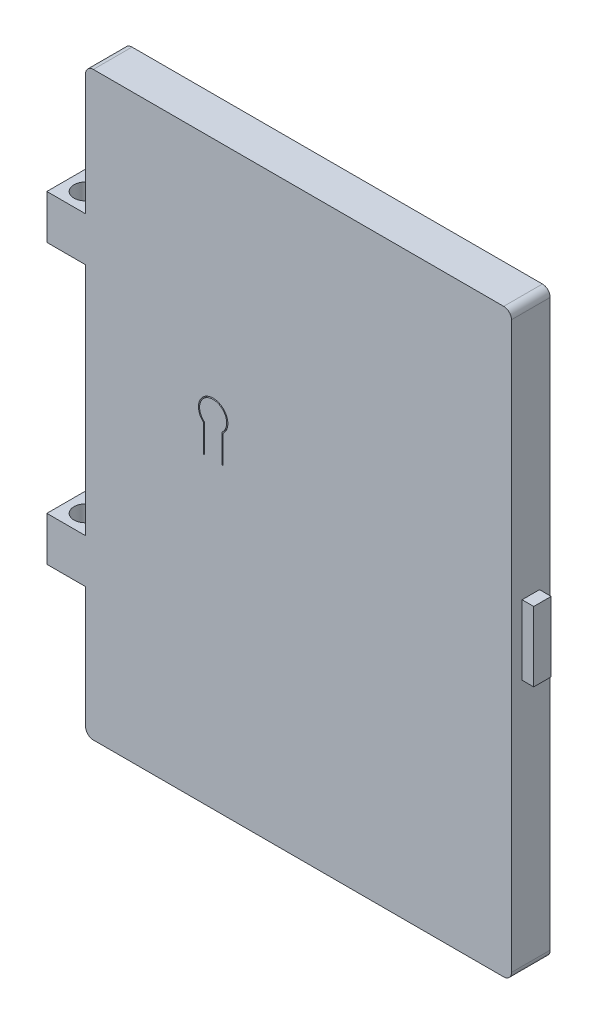
from build123d import *

# Parameters (mm, degrees)
SKETCH1_W           = 110
SKETCH1_H           = 150
BOSS_EXTRUDE1_DEPTH = 10
CUT_EXTRUDE1_DEPTH  = 6
SKETCH3_R           = 2.5
BOSS_EXTRUDE2_DEPTH = 18
CUT_EXTRUDE2_START  = -12
SKETCH5_R           = 1.1
CUT_EXTRUDE2_DEPTH  = 5
CUT_EXTRUDE3_START  = 0.5
CUT_EXTRUDE3_DEPTH  = 4
SKETCH7_R           = 1.875
BOSS_EXTRUDE3_DEPTH = 11.5
CUT_EXTRUDE4_DEPTH  = 4
SKETCH9_W           = 10
SKETCH9_H           = 11.4
BOSS_EXTRUDE4_DEPTH = 10
SKETCH10_R          = 3
CUT_EXTRUDE5_DEPTH  = 161.819432905
SKETCH11_W          = 4.5
SKETCH11_H          = 18
BOSS_EXTRUDE5_DEPTH = 3
FILLET1_R           = 2


with BuildPart() as part:
    # Sketch1 → Boss-Extrude1 (new body)
    with BuildSketch(Plane.XY):
        with Locations((55, 75)):
            Rectangle(SKETCH1_W, SKETCH1_H)
    extrude(amount=BOSS_EXTRUDE1_DEPTH)

    # Sketch2 → Cut-Extrude1 (cut)
    with BuildSketch(Plane(origin=(0, 0, 0), x_dir=(-1, 0, 0), z_dir=(0, 0, -1))):
        with BuildLine():
            Line((-93, 53), (-7, 53))
            ThreePointArc((-7, 53), (-5.585786438, 53.585786438), (-5, 55))
            Line((-5, 55), (-5, 113))
            ThreePointArc((-5, 113), (-5.585786438, 114.414213562), (-7, 115))
            Line((-7, 115), (-93, 115))
            ThreePointArc((-93, 115), (-94.414213562, 114.414213562), (-95, 113))
            Line((-95, 113), (-95, 55))
            ThreePointArc((-95, 55), (-94.414213562, 53.585786438), (-93, 53))
        make_face()
    extrude(amount=-CUT_EXTRUDE1_DEPTH, mode=Mode.SUBTRACT)

    # Sketch3 → Boss-Extrude2 (add)
    with BuildSketch(Plane(origin=(0, 0, 6), x_dir=(-1, 0, 0), z_dir=(0, 0, -1))):
        with Locations(Location((-91.46, 95.2, 0), (0, 0, 180))):
            Circle(SKETCH3_R)
        with Locations(Location((-70.96, 111.2, 0), (0, 0, 180))):
            Circle(SKETCH3_R)
        with Locations(Location((-9.46, 110.2, 0), (0, 0, 180))):
            Circle(SKETCH3_R)
        with Locations(Location((-9.46, 76.2, 0), (0, 0, 180))):
            Circle(SKETCH3_R)
        with Locations(Location((-24.96, 58.2, 0), (0, 0, 180))):
            Circle(SKETCH3_R)
        with Locations(Location((-51.96, 58.2, 0), (0, 0, 180))):
            Circle(SKETCH3_R)
        with Locations(Location((-91.46, 58.2, 0), (0, 0, 180))):
            Circle(SKETCH3_R)
    extrude(amount=BOSS_EXTRUDE2_DEPTH)

    # Sketch5 → Cut-Extrude2 (cut)
    with BuildSketch(Plane.XY.offset(CUT_EXTRUDE2_START)):
        with Locations(Location((91.46, 58.2, 0), (0, 0, 180))):
            Circle(SKETCH5_R)
        with Locations(Location((51.96, 58.2, 0), (0, 0, 180))):
            Circle(SKETCH5_R)
        with Locations(Location((24.96, 58.2, 0), (0, 0, 180))):
            Circle(SKETCH5_R)
        with Locations(Location((9.46, 76.2, 0), (0, 0, 180))):
            Circle(SKETCH5_R)
        with Locations(Location((9.46, 110.2, 0), (0, 0, 180))):
            Circle(SKETCH5_R)
        with Locations(Location((70.96, 111.2, 0), (0, 0, 180))):
            Circle(SKETCH5_R)
        with Locations(Location((91.46, 95.2, 0), (0, 0, 180))):
            Circle(SKETCH5_R)
    extrude(amount=CUT_EXTRUDE2_DEPTH, mode=Mode.SUBTRACT)

    # Sketch6 → Cut-Extrude3 (cut)
    with BuildSketch(Plane(origin=(0, 0, 6), x_dir=(-1, 0, 0), z_dir=(0, 0, -1)).offset(CUT_EXTRUDE3_START)):
        with BuildLine():
            Line((-87.5, 78), (-83.5, 78))
            ThreePointArc((-83.5, 78), (-82.085786438, 78.585786438), (-81.5, 80))
            Line((-81.5, 80), (-81.5, 91))
            ThreePointArc((-81.5, 91), (-82.085786438, 92.414213562), (-83.5, 93))
            Line((-83.5, 93), (-87.5, 93))
            ThreePointArc((-87.5, 93), (-88.914213562, 92.414213562), (-89.5, 91))
            Line((-89.5, 91), (-89.5, 80))
            ThreePointArc((-89.5, 80), (-88.914213562, 78.585786438), (-87.5, 78))
        make_face()
    extrude(amount=-CUT_EXTRUDE3_DEPTH, mode=Mode.SUBTRACT)

    # Sketch7 → Boss-Extrude3 (add)
    with BuildSketch(Plane(origin=(0, 0, 6), x_dir=(-1, 0, 0), z_dir=(0, 0, -1))):
        with Locations(Location((-32.95, 88.15, 0), (0, 0, 180))):
            Circle(SKETCH7_R)
    extrude(amount=BOSS_EXTRUDE3_DEPTH)

    # Sketch8 → Cut-Extrude4 (cut)
    with BuildSketch(Plane.XY.offset(10)):
        with BuildLine():
            Line((30.7, 78.15), (30.7, 85.469048676))
            ThreePointArc((30.7, 85.469048676), (32.95, 91.65), (35.2, 85.469048676))
            Line((35.2, 85.469048676), (35.2, 78.15))
            Line((35.2, 78.15), (35.5, 78.15))
            Line((35.5, 78.15), (35.5, 85.332643083))
            ThreePointArc((35.5, 85.332643083), (32.95, 91.95), (30.4, 85.332643083))
            Line((30.4, 85.332643083), (30.4, 78.15))
            Line((30.4, 78.15), (30.7, 78.15))
        make_face()
    extrude(amount=-CUT_EXTRUDE4_DEPTH, mode=Mode.SUBTRACT)

    # Sketch9 → Boss-Extrude4 (add)
    with BuildSketch(Plane.ZY):
        with Locations((5, 39)):
            Rectangle(SKETCH9_W, SKETCH9_H)
        with Locations((5, 111)):
            Rectangle(SKETCH9_W, SKETCH9_H)
    extrude(amount=BOSS_EXTRUDE4_DEPTH)

    # Sketch10 → Cut-Extrude5 (cut, through all)
    with BuildSketch(Plane(origin=(0, 116.7, 0), x_dir=(1, 0, 0), z_dir=(0, 1, 0))):
        with Locations(Location((-5, -5, 0), (0, 0, 270))):
            Circle(SKETCH10_R)
    extrude(amount=-CUT_EXTRUDE5_DEPTH, mode=Mode.SUBTRACT)

    # Sketch11 → Boss-Extrude5 (add)
    with BuildSketch(Plane(origin=(110, 0, 0), x_dir=(0, 0, -1), z_dir=(1, 0, 0))):
        with Locations((-5, 75)):
            Rectangle(SKETCH11_W, SKETCH11_H)
    extrude(amount=BOSS_EXTRUDE5_DEPTH)

    # Fillet1
    fillet1_edges = [part.edges().sort_by_distance(p)[0] for p in [
        (0, 150, 5),
        (110, 150, 5),
        (110, 0, 5),
        (0, 0, 5),
    ]]
    fillet(fillet1_edges, radius=FILLET1_R)


solid = part.part
